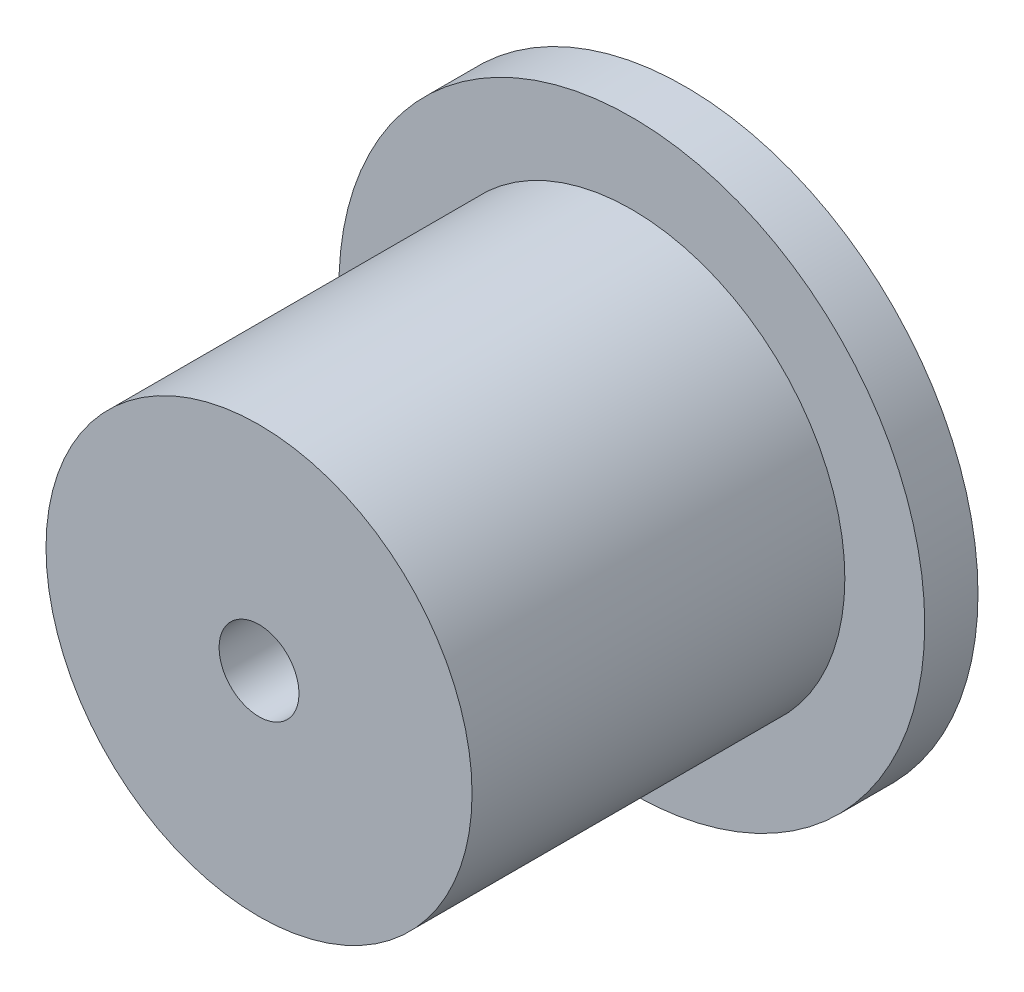
from build123d import *

# Parameters (mm, degrees)
SKETCH1_R                               = 11
BOSS_EXTRUDE1_DEPTH                     = 2
SKETCH2_R                               = 8
BOSS_EXTRUDE2_DEPTH                     = 14
CBORE_FOR_M5_HEX_HEAD_BOLT1_D           = 3
CBORE_FOR_M5_HEX_HEAD_BOLT1_CBORE_D     = 6
CBORE_FOR_M5_HEX_HEAD_BOLT1_CBORE_DEPTH = 3


with BuildPart() as part:
    # Sketch1 → Boss-Extrude1 (new body)
    with BuildSketch(Plane.XY):
        Circle(SKETCH1_R)
    extrude(amount=BOSS_EXTRUDE1_DEPTH)

    # Sketch2 → Boss-Extrude2 (add)
    with BuildSketch(Plane.XY.offset(2)):
        Circle(SKETCH2_R)
    extrude(amount=BOSS_EXTRUDE2_DEPTH)

    # CBORE for M5 Hex Head Bolt1 (through all)
    with Locations(Plane(origin=(0, 0, 0), x_dir=(-1, 0, 0), z_dir=(0, 0, -1))):
        with Locations((0, 0)):
            CounterBoreHole(CBORE_FOR_M5_HEX_HEAD_BOLT1_D / 2, CBORE_FOR_M5_HEX_HEAD_BOLT1_CBORE_D / 2, CBORE_FOR_M5_HEX_HEAD_BOLT1_CBORE_DEPTH)


solid = part.part
